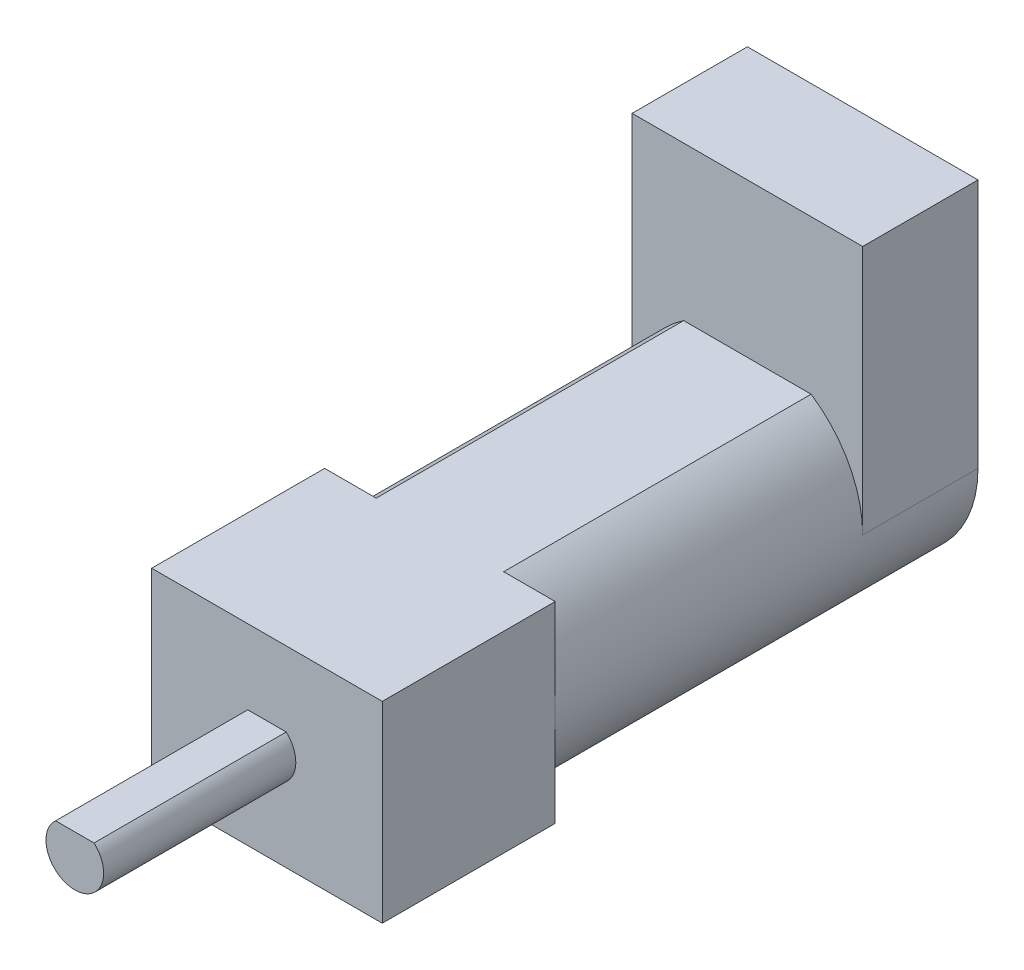
from build123d import *

# Parameters (mm, degrees)
ESQUISSE1_W        = 12
ESQUISSE1_H        = 10
BOSS_EXTRU_1_DEPTH = 9
BOSS_EXTRU_2_DEPTH = 10
BOSS_EXTRU_3_DEPTH = 16
BOSS_EXTRU_4_DEPTH = 6


with BuildPart() as part:
    # Esquisse1 → Boss.-Extru.1 (new body)
    with BuildSketch(Plane.XY):
        Rectangle(ESQUISSE1_W, ESQUISSE1_H)
    extrude(amount=BOSS_EXTRU_1_DEPTH)

    # Esquisse2 → Boss.-Extru.2 (add)
    with BuildSketch(Plane.XY.offset(9)):
        with BuildLine():
            Line((-1, 1.118033989), (1, 1.118033989))
            ThreePointArc((1, 1.118033989), (0, -1.5), (-1, 1.118033989))
        make_face()
    extrude(amount=BOSS_EXTRU_2_DEPTH)

    # Esquisse3 → Boss.-Extru.3 (add)
    with BuildSketch(Plane(origin=(0, 0, 0), x_dir=(-1, 0, 0), z_dir=(0, 0, -1))):
        with BuildLine():
            Line((-3.31662479, 5), (3.31662479, 5))
            ThreePointArc((3.31662479, 5), (6, 0), (3.31662479, -5))
            Line((3.31662479, -5), (-3.31662479, -5))
            ThreePointArc((-3.31662479, -5), (-6, 0), (-3.31662479, 5))
        make_face()
    extrude(amount=BOSS_EXTRU_3_DEPTH)

    # Esquisse4 → Boss.-Extru.4 (add)
    with BuildSketch(Plane(origin=(0, 0, -16), x_dir=(-1, 0, 0), z_dir=(0, 0, -1))):
        with BuildLine():
            Line((-3.31662479, -5), (3.31662479, -5))
            ThreePointArc((3.31662479, -5), (5.286764074, -2.837274331), (6, 0))
            Line((6, 0), (6, 13))
            Line((6, 13), (-6, 13))
            Line((-6, 13), (-6, 0))
            ThreePointArc((-6, 0), (-5.286764074, -2.837274331), (-3.31662479, -5))
        make_face()
    extrude(amount=BOSS_EXTRU_4_DEPTH)


solid = part.part
